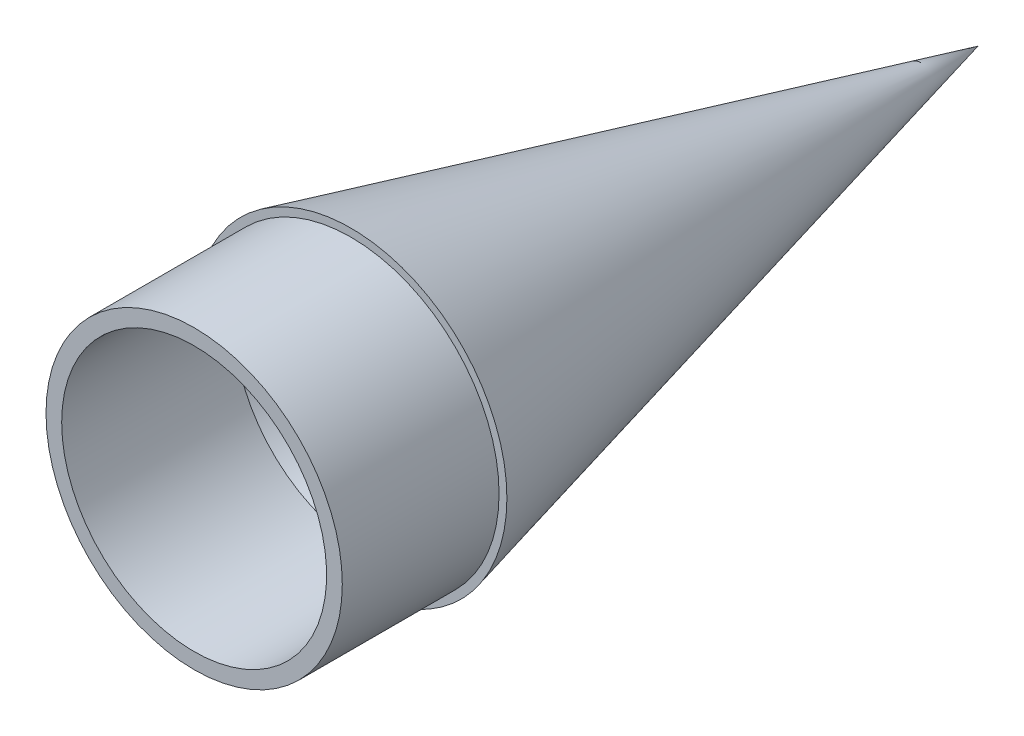
from build123d import *

# Parameters (mm, degrees)
SHELL_1_T = -2


with BuildPart() as part:
    # Эскиз1 → Повернуть1 (revolve)
    with BuildSketch(Plane(origin=(0, 0, 0), x_dir=(1, 0, 0), z_dir=(0, 1, 0)), mode=Mode.PRIVATE) as revolve_1_sk:
        Polygon((0, 80), (-19.9, 0), (-18.9, 0), (-18.9, -20), (-17.643663556, -20), (0, -20), align=None)
    revolve(revolve_1_sk.sketch.rotate(Axis((0, 0, 20), (0, 0, -1)), 180), axis=Axis((0, 0, 20), (0, 0, -1)))

    # Оболочка1
    shell_1_openings = [part.faces().sort_by_distance(p)[0] for p in [
        (0, 0, 20),
    ]]
    offset(amount=SHELL_1_T, openings=shell_1_openings, kind=Kind.INTERSECTION)


solid = part.part
